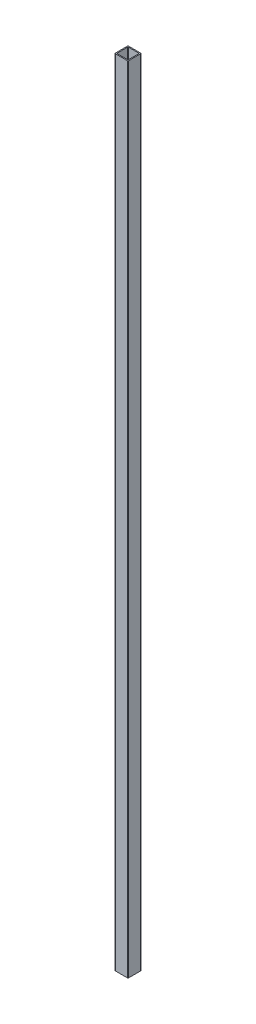
from build123d import *

# Parameters (mm, degrees)
BOSS_EXTRUDE1_DEPTH = 1200


with BuildPart() as part:
    # Sketch1 → Boss-Extrude1 (new body)
    with BuildSketch(Plane(origin=(0, 0, 0), x_dir=(1, 0, 0), z_dir=(0, 1, 0))):
        with BuildLine():
            Line((-9, -10), (9, -10))
            ThreePointArc((9, -10), (9.707106781, -9.707106781), (10, -9))
            Line((10, -9), (10, 9))
            ThreePointArc((10, 9), (9.707106781, 9.707106781), (9, 10))
            Line((9, 10), (-9, 10))
            ThreePointArc((-9, 10), (-9.707106781, 9.707106781), (-10, 9))
            Line((-10, 9), (-10, -9))
            ThreePointArc((-10, -9), (-9.707106781, -9.707106781), (-9, -10))
        make_face()
        with BuildLine():
            Line((-7.5, -8.5), (7.5, -8.5))
            ThreePointArc((7.5, -8.5), (8.207106781, -8.207106781), (8.5, -7.5))
            Line((8.5, -7.5), (8.5, 7.5))
            ThreePointArc((8.5, 7.5), (8.207106781, 8.207106781), (7.5, 8.5))
            Line((7.5, 8.5), (-7.5, 8.5))
            ThreePointArc((-7.5, 8.5), (-8.207106781, 8.207106781), (-8.5, 7.5))
            Line((-8.5, 7.5), (-8.5, -7.5))
            ThreePointArc((-8.5, -7.5), (-8.207106781, -8.207106781), (-7.5, -8.5))
        make_face(mode=Mode.SUBTRACT)
    extrude(amount=BOSS_EXTRUDE1_DEPTH)


solid = part.part
